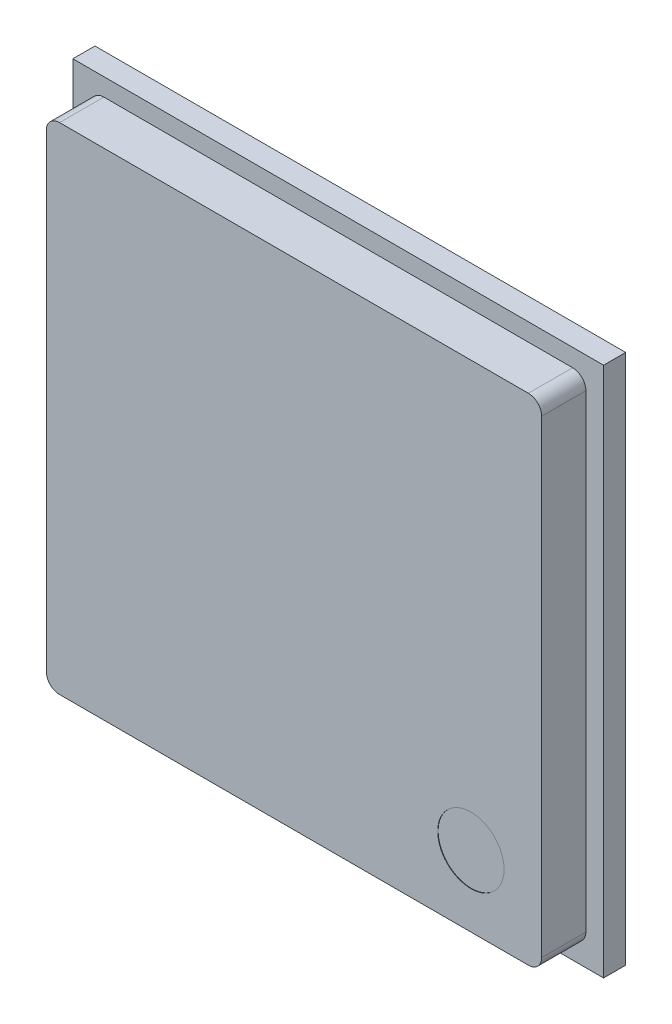
from build123d import *

# Parameters (mm, degrees)
ESQUISSE1_W             = 12
ESQUISSE1_H             = 12
BOSS_EXTRU_1_DEPTH      = 0.5
ESQUISSE2_W             = 11.2
ESQUISSE2_H             = 11.2
BOSS_EXTRU_2_DEPTH      = 1
CONG_1_R                = 0.3
ESQUISSE3_R             = 0.75
ENL_V_MAT_EXTRU_1_DEPTH = 0.01


with BuildPart() as part:
    # Esquisse1 → Boss.-Extru.1 (new body)
    with BuildSketch(Plane.XY):
        with Locations((6, -6)):
            Rectangle(ESQUISSE1_W, ESQUISSE1_H)
    extrude(amount=BOSS_EXTRU_1_DEPTH)

    # Esquisse2 → Boss.-Extru.2 (add)
    with BuildSketch(Plane.XY.offset(0.5)):
        with Locations((6, -6)):
            Rectangle(ESQUISSE2_W, ESQUISSE2_H)
    extrude(amount=BOSS_EXTRU_2_DEPTH)

    # Congé1
    cong_1_edges = [part.edges().sort_by_distance(p)[0] for p in [
        (0.4, -0.4, 1),
        (0.4, -11.6, 1),
        (11.6, -11.6, 1),
        (11.6, -0.4, 1),
    ]]
    fillet(cong_1_edges, radius=CONG_1_R)

    # Esquisse3 → Enlèv. mat.-Extru.1 (cut)
    with BuildSketch(Plane.XY.offset(1.5)):
        with Locations((10, -10)):
            Circle(ESQUISSE3_R)
    extrude(amount=-ENL_V_MAT_EXTRU_1_DEPTH, mode=Mode.SUBTRACT)


solid = part.part
